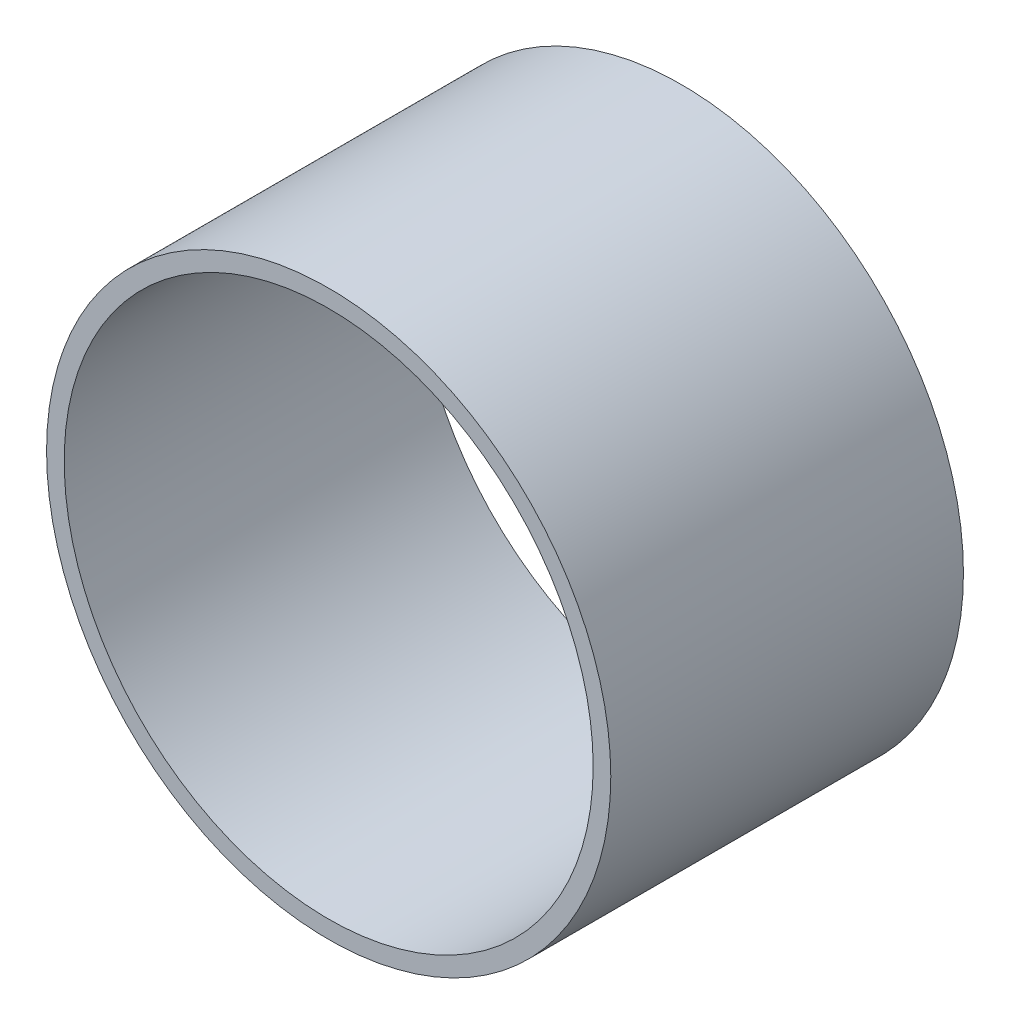
from build123d import *

# Parameters (mm, degrees)
SKETCH_1_W = 60
SKETCH_1_H = 3


with BuildPart() as part:
    # 草图1 → 旋转1 (revolve)
    with BuildSketch(Plane(origin=(0, 0, 0), x_dir=(0, 0, -1), z_dir=(1, 0, 0)), mode=Mode.PRIVATE) as revolve_1_sk:
        with Locations((171, 46.5)):
            Rectangle(SKETCH_1_W, SKETCH_1_H)
    revolve(revolve_1_sk.sketch.rotate(Axis((0, 0, -136), (0, 0, -1)), 90), axis=Axis((0, 0, -136), (0, 0, -1)))


solid = part.part
